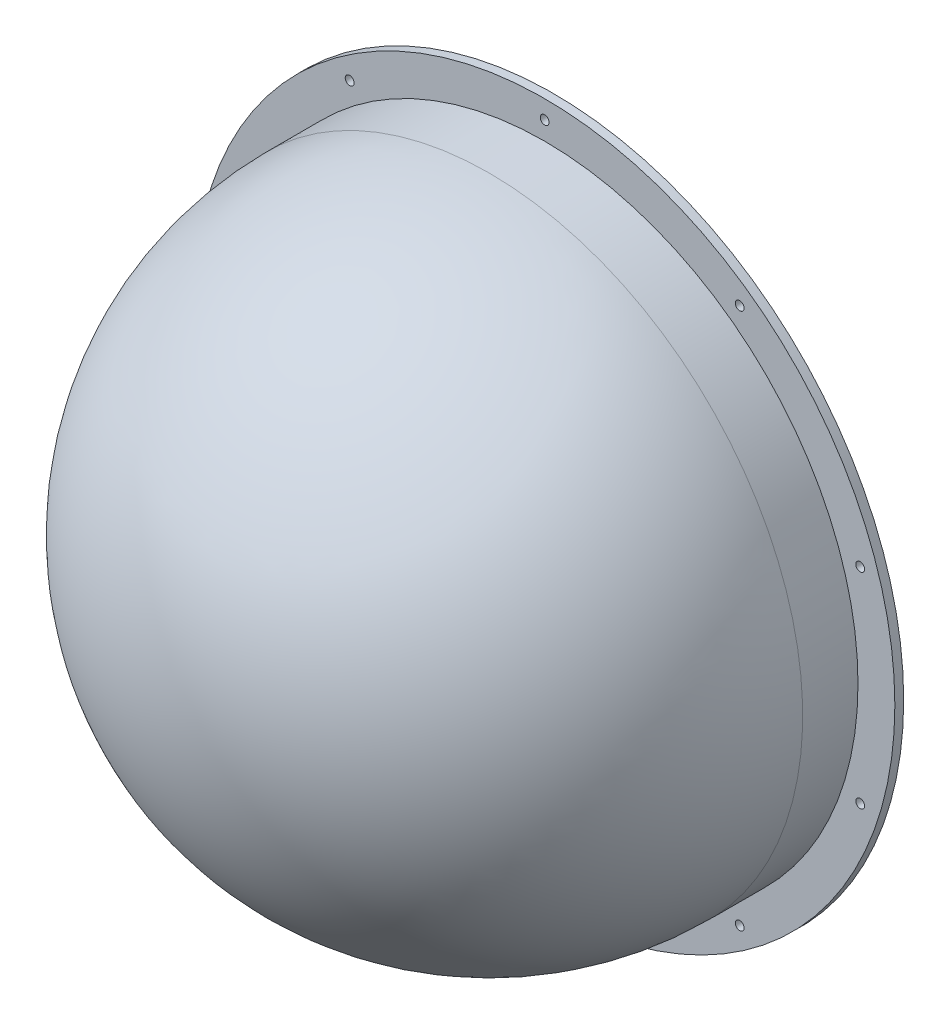
from build123d import *

# Parameters (mm, degrees)
SKETCH1_R           = 475
SKETCH1_R_2         = 6
SKETCH1_R_3         = 419
BOSS_EXTRUDE1_DEPTH = 12


with BuildPart() as part:
    # Sketch1 → Boss-Extrude1 (new body)
    with BuildSketch(Plane.XY):
        Circle(SKETCH1_R)
        with Locations((0, 450)):
            Circle(SKETCH1_R_2, mode=Mode.SUBTRACT)
        with Locations((264.503363532, 364.057647469)):
            Circle(SKETCH1_R_2, mode=Mode.SUBTRACT)
        with Locations((427.975432333, 139.057647469)):
            Circle(SKETCH1_R_2, mode=Mode.SUBTRACT)
        with Locations((427.975432333, -139.057647469)):
            Circle(SKETCH1_R_2, mode=Mode.SUBTRACT)
        with Locations((264.503363532, -364.057647469)):
            Circle(SKETCH1_R_2, mode=Mode.SUBTRACT)
        with Locations((0, -450)):
            Circle(SKETCH1_R_2, mode=Mode.SUBTRACT)
        with Locations((-264.503363532, -364.057647469)):
            Circle(SKETCH1_R_2, mode=Mode.SUBTRACT)
        with Locations((-427.975432333, -139.057647469)):
            Circle(SKETCH1_R_2, mode=Mode.SUBTRACT)
        with Locations((-427.975432333, 139.057647469)):
            Circle(SKETCH1_R_2, mode=Mode.SUBTRACT)
        with Locations((-264.503363532, 364.057647469)):
            Circle(SKETCH1_R_2, mode=Mode.SUBTRACT)
        Circle(SKETCH1_R_3, mode=Mode.SUBTRACT)
    extrude(amount=BOSS_EXTRUDE1_DEPTH)

    # Sketch4 → Revolve2 (revolve)
    with BuildSketch(Plane(origin=(0, 0, 0), x_dir=(0, 0, -1), z_dir=(1, 0, 0))):
        with BuildLine():
            Line((-12, 425), (-87, 425))
            ThreePointArc((-87, 425), (-387.520382004, 300.520382004), (-512, 0))
            Line((-512, 0), (-506, 0))
            ThreePointArc((-506, 0), (-383.277741317, 296.277741317), (-87, 419))
            Line((-87, 419), (-12, 419))
            Line((-12, 419), (-12, 425))
        make_face()
    revolve(axis=Axis((0, 0, 12), (0, 0, 1)))


solid = part.part
